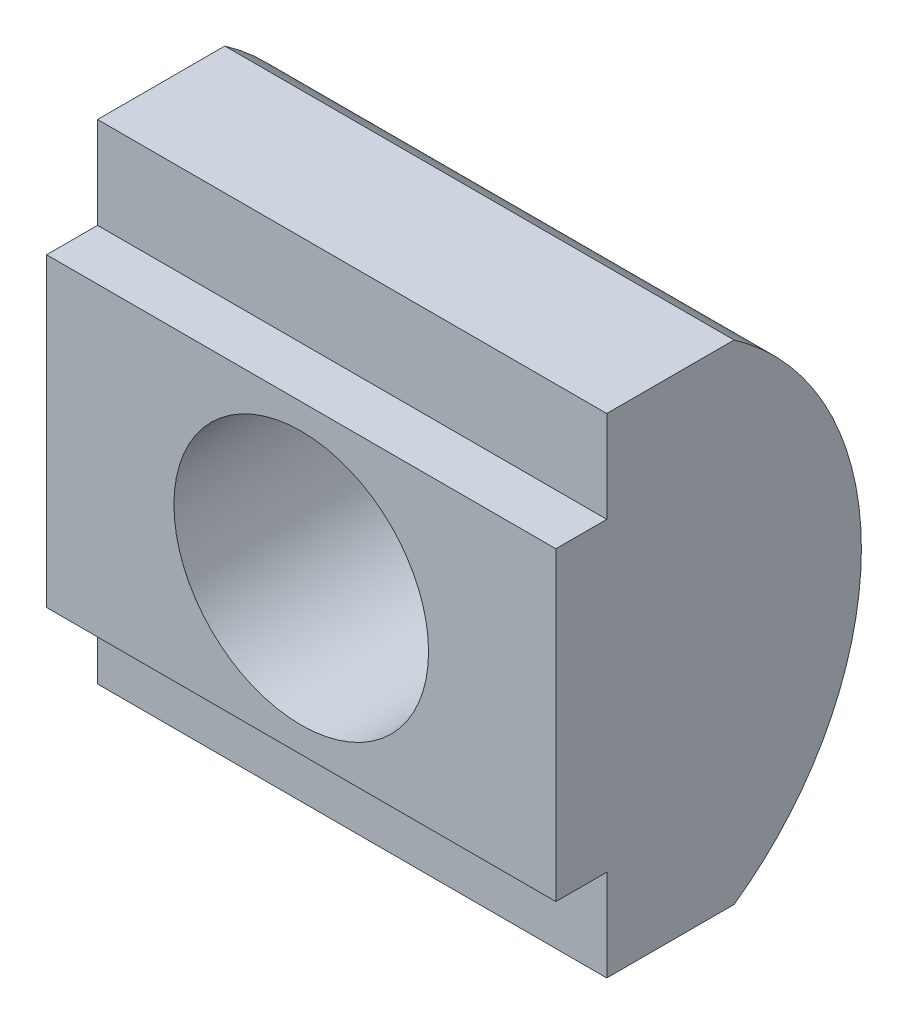
from build123d import *

# Parameters (mm, degrees)
SKETCH_1_W          = 10
SKETCH_1_H          = 6
SKETCH_1_R          = 2.5
EXTRUDE_1_DEPTH     = 6
SKETCH_2_W          = 10
SKETCH_2_H          = 9.6
SKETCH_2_R          = 2.5
EXTRUDE_2_DEPTH     = 5
CUT_EXTRUDE_1_DEPTH = 15


with BuildPart() as part:
    # 草图1 → 凸台-拉伸1 (new body)
    with BuildSketch(Plane.XY):
        Rectangle(SKETCH_1_W, SKETCH_1_H)
        Circle(SKETCH_1_R, mode=Mode.SUBTRACT)
    extrude(amount=EXTRUDE_1_DEPTH)

    # 草图2 → 凸台-拉伸2 (add)
    with BuildSketch(Plane.XY):
        Rectangle(SKETCH_2_W, SKETCH_2_H)
        Circle(SKETCH_2_R, mode=Mode.SUBTRACT)
    extrude(amount=EXTRUDE_2_DEPTH)

    # 草图3 → 切除-拉伸1 (cut)
    with BuildSketch(Plane(origin=(5, 0, 0), x_dir=(0, 0, -1), z_dir=(1, 0, 0))):
        with BuildLine():
            Line((0, 4.8), (-2.5, 4.8))
            ThreePointArc((-2.5, 4.8), (-0.662457295, 2.706011826), (0, 0))
            Line((0, 0), (0, 4.8))
        make_face()
        with BuildLine():
            Line((0, -4.8), (0, 0))
            ThreePointArc((0, 0), (-0.662457295, -2.706011826), (-2.5, -4.8))
            Line((-2.5, -4.8), (0, -4.8))
        make_face()
    extrude(amount=-CUT_EXTRUDE_1_DEPTH, mode=Mode.SUBTRACT)


solid = part.part
